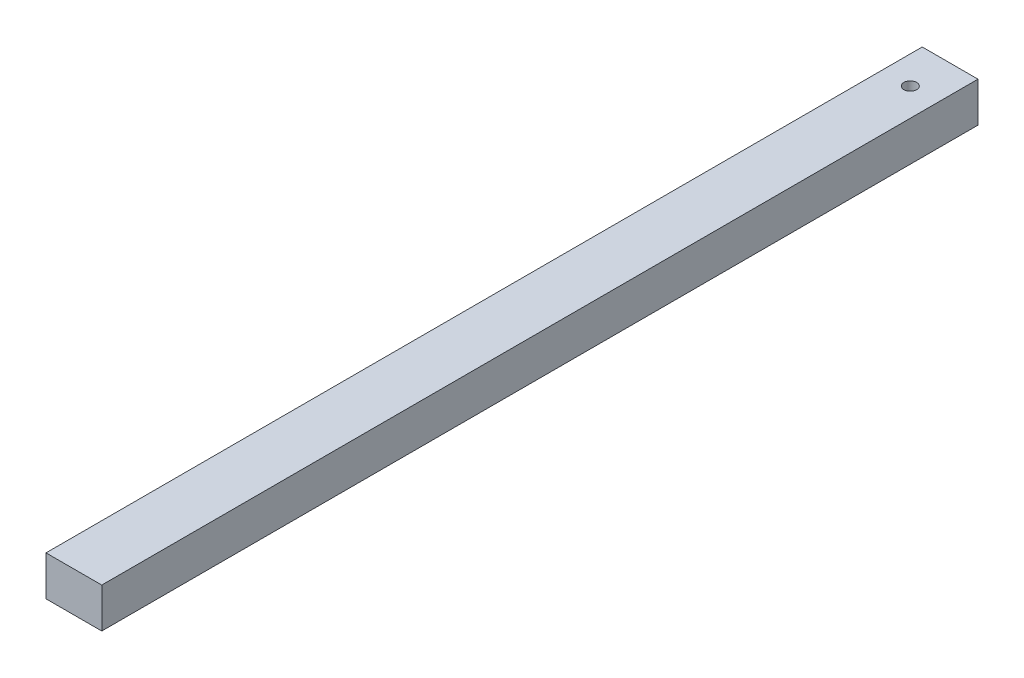
from build123d import *

# Parameters (mm, degrees)
SKETCH2_W           = 35
SKETCH2_H           = 25
BOSS_EXTRUDE1_DEPTH = 550
SKETCH3_R           = 4
CUT_EXTRUDE2_DEPTH  = 551.84594035


with BuildPart() as part:
    # Sketch2 → Boss-Extrude1 (new body)
    with BuildSketch(Plane.XY):
        Rectangle(SKETCH2_W, SKETCH2_H)
    extrude(amount=BOSS_EXTRUDE1_DEPTH)

    # Sketch3 → Cut-Extrude2 (cut, through all)
    with BuildSketch(Plane(origin=(0, 12.5, 0), x_dir=(1, 0, 0), z_dir=(0, 1, 0))):
        with Locations(Location((0, -25, 0), (0, 0, 270))):
            Circle(SKETCH3_R)
    extrude(amount=-CUT_EXTRUDE2_DEPTH, mode=Mode.SUBTRACT)


solid = part.part
